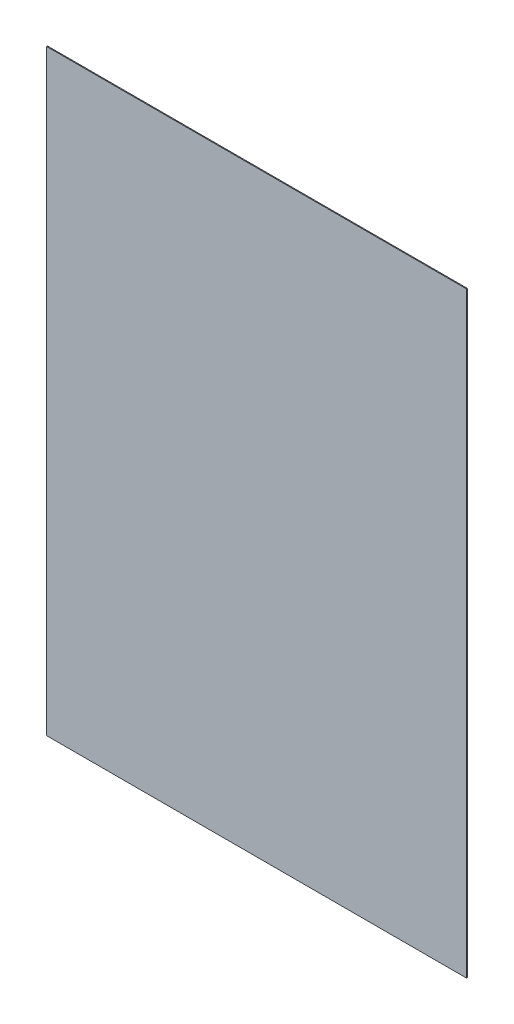
from build123d import *

# Parameters (mm, degrees)
CROQUIS1_W              = 900
CROQUIS1_H              = 1280
SALIENTE_EXTRUIR1_DEPTH = 1.9


with BuildPart() as part:
    # Croquis1 → Saliente-Extruir1 (new body)
    with BuildSketch(Plane.XY):
        Rectangle(CROQUIS1_W, CROQUIS1_H)
    extrude(amount=SALIENTE_EXTRUIR1_DEPTH)


solid = part.part
